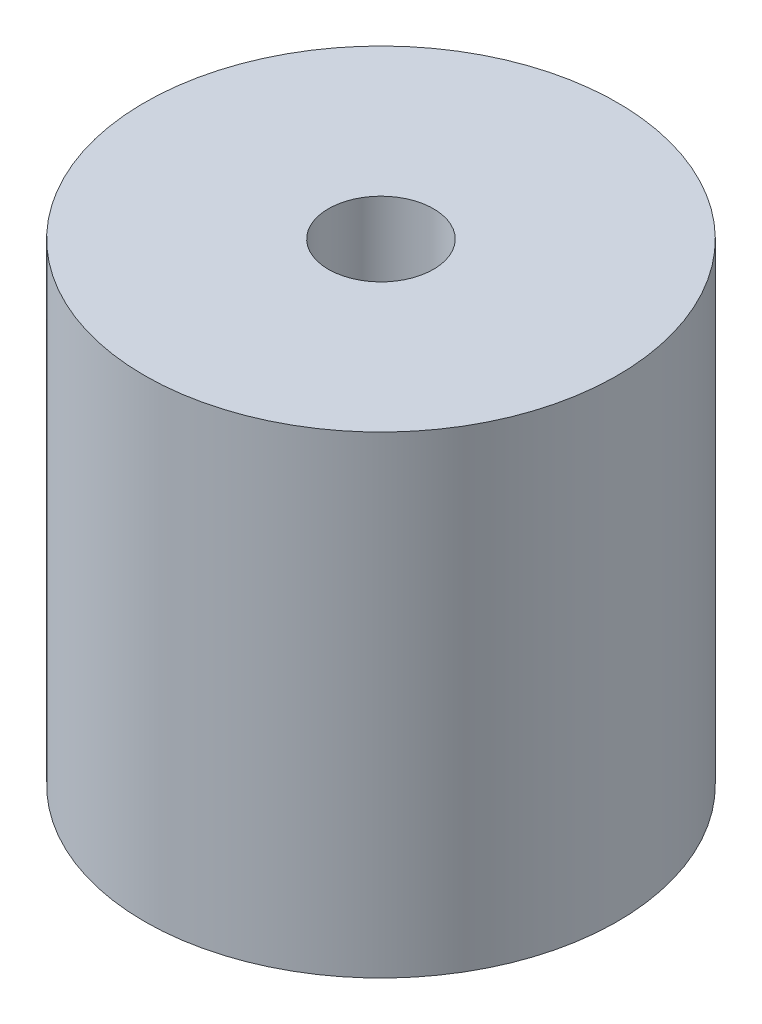
from build123d import *

# Parameters (mm, degrees)
SKETCH1_R           = 18
SKETCH1_R_2         = 4
BOSS_EXTRUDE1_DEPTH = 36


with BuildPart() as part:
    # Sketch1 → Boss-Extrude1 (new body)
    with BuildSketch(Plane(origin=(0, 0, 0), x_dir=(1, 0, 0), z_dir=(0, 1, 0))):
        with Locations(Location((0, 0, 0), (0, 0, 270))):
            Circle(SKETCH1_R)
        with Locations(Location((0, 0, 0), (0, 0, 270))):
            Circle(SKETCH1_R_2, mode=Mode.SUBTRACT)
    extrude(amount=BOSS_EXTRUDE1_DEPTH)


solid = part.part
